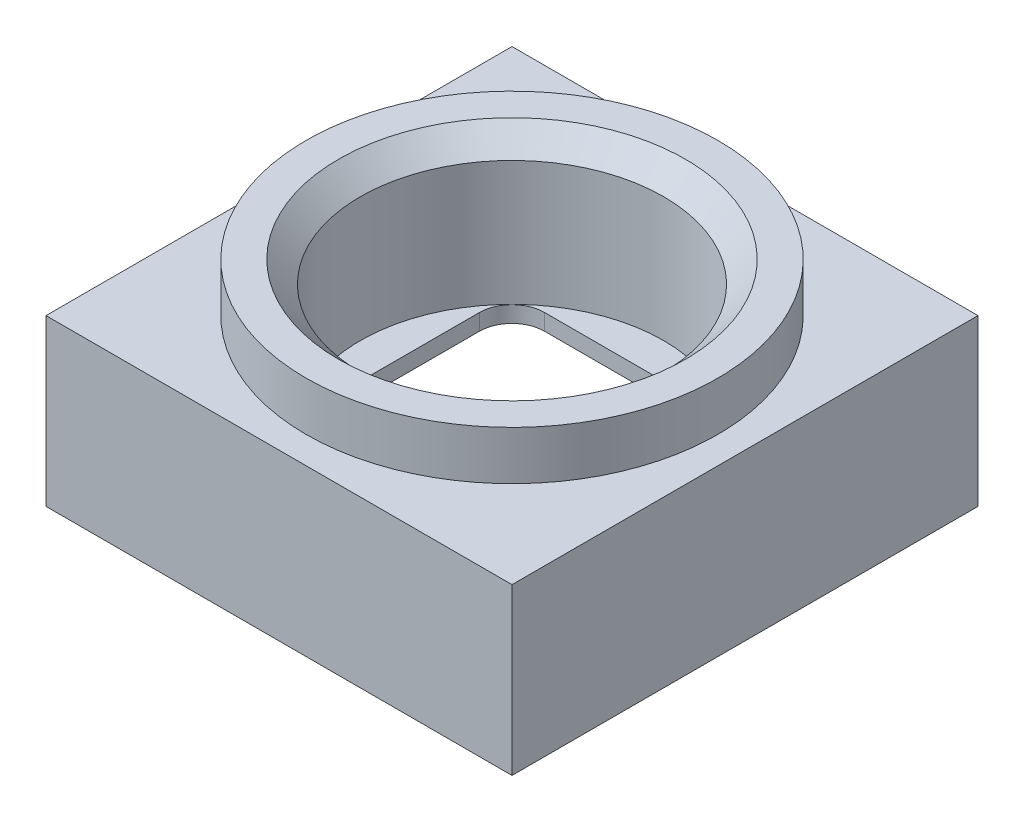
from build123d import *

# Parameters (mm, degrees)
SKIZZE2_W                       = 8.6
SKIZZE2_H                       = 8.6
SKIZZE2_W_2                     = 8
SKIZZE2_H_2                     = 8
AUFSATZ_LINEAR_AUSTRAGEN1_DEPTH = 0.6
SKIZZE5_W                       = 8.6
SKIZZE5_H                       = 8.6
AUFSATZ_LINEAR_AUSTRAGEN3_DEPTH = 0.35
SKIZZE4_W                       = 8.6
SKIZZE4_H                       = 8.6
AUFSATZ_LINEAR_AUSTRAGEN2_DEPTH = 0.3
SKIZZE7_W                       = 8.6
SKIZZE7_H                       = 8.6
SKIZZE7_R                       = 2.8
AUFSATZ_LINEAR_AUSTRAGEN4_DEPTH = 1.8
SKIZZE8_R                       = 3.8
SKIZZE8_R_2                     = 2.8
AUFSATZ_LINEAR_AUSTRAGEN5_DEPTH = 0.9
FASE1_SIZE                      = 0.4


with BuildPart() as part:
    # Skizze2 → Aufsatz-Linear austragen1 (new body)
    with BuildSketch(Plane(origin=(0, 0, 0), x_dir=(1, 0, 0), z_dir=(0, 1, 0))):
        Rectangle(SKIZZE2_W, SKIZZE2_H)
        Rectangle(SKIZZE2_W_2, SKIZZE2_H_2, mode=Mode.SUBTRACT)
    extrude(amount=AUFSATZ_LINEAR_AUSTRAGEN1_DEPTH)

    # Skizze5 → Aufsatz-Linear austragen3 (add)
    with BuildSketch(Plane(origin=(0, 0.6, 0), x_dir=(1, 0, 0), z_dir=(0, 1, 0))):
        Rectangle(SKIZZE5_W, SKIZZE5_H)
        with BuildLine():
            Line((-2.764589803, 3.2), (2.764589803, 3.2))
            ThreePointArc((2.764589803, 3.2), (3.347487373, 3.347487373), (3.2, 2.764589803))
            Line((3.2, 2.764589803), (3.2, -2.764589803))
            ThreePointArc((3.2, -2.764589803), (3.347487373, -3.347487373), (2.764589803, -3.2))
            Line((2.764589803, -3.2), (-2.764589803, -3.2))
            ThreePointArc((-2.764589803, -3.2), (-3.347487373, -3.347487373), (-3.2, -2.764589803))
            Line((-3.2, -2.764589803), (-3.2, 2.764589803))
            ThreePointArc((-3.2, 2.764589803), (-3.347487373, 3.347487373), (-2.764589803, 3.2))
        make_face(mode=Mode.SUBTRACT)
    extrude(amount=AUFSATZ_LINEAR_AUSTRAGEN3_DEPTH)

    # Skizze4 → Aufsatz-Linear austragen2 (add)
    with BuildSketch(Plane(origin=(0, 0.95, 0), x_dir=(1, 0, 0), z_dir=(0, 1, 0))):
        Rectangle(SKIZZE4_W, SKIZZE4_H)
        with BuildLine():
            Line((-1.55, 2.15), (1.55, 2.15))
            ThreePointArc((1.55, 2.15), (1.974264069, 1.974264069), (2.15, 1.55))
            Line((2.15, 1.55), (2.15, -1.55))
            ThreePointArc((2.15, -1.55), (1.974264069, -1.974264069), (1.55, -2.15))
            Line((1.55, -2.15), (-1.55, -2.15))
            ThreePointArc((-1.55, -2.15), (-1.974264069, -1.974264069), (-2.15, -1.55))
            Line((-2.15, -1.55), (-2.15, 1.55))
            ThreePointArc((-2.15, 1.55), (-1.974264069, 1.974264069), (-1.55, 2.15))
        make_face(mode=Mode.SUBTRACT)
    extrude(amount=AUFSATZ_LINEAR_AUSTRAGEN2_DEPTH)

    # Skizze7 → Aufsatz-Linear austragen4 (add)
    with BuildSketch(Plane(origin=(0, 1.25, 0), x_dir=(1, 0, 0), z_dir=(0, 1, 0))):
        Rectangle(SKIZZE7_W, SKIZZE7_H)
        with Locations(Location((0, 0, 0), (0, 0, 270))):
            Circle(SKIZZE7_R, mode=Mode.SUBTRACT)
    extrude(amount=AUFSATZ_LINEAR_AUSTRAGEN4_DEPTH)

    # Skizze8 → Aufsatz-Linear austragen5 (add)
    with BuildSketch(Plane(origin=(0, 3.05, 0), x_dir=(1, 0, 0), z_dir=(0, 1, 0))):
        with Locations(Location((0, 0, 0), (0, 0, 270))):
            Circle(SKIZZE8_R)
        with Locations(Location((0, 0, 0), (0, 0, 270))):
            Circle(SKIZZE8_R_2, mode=Mode.SUBTRACT)
    extrude(amount=AUFSATZ_LINEAR_AUSTRAGEN5_DEPTH)

    # Fase1
    fase1_edges = [part.edges().sort_by_distance(p)[0] for p in [
        (0, 3.95, -2.8),
    ]]
    chamfer(fase1_edges, length=FASE1_SIZE)


solid = part.part
